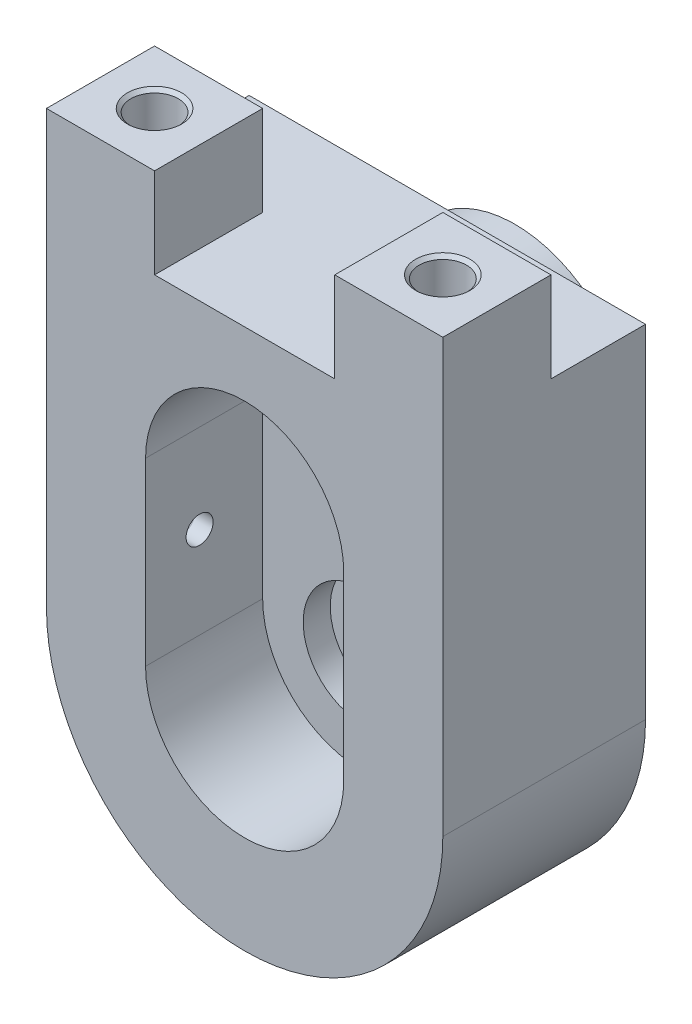
from build123d import *

# Parameters (mm, degrees)
EXTRUDE_1_DEPTH              = 45
CUT_EXTRUDE_1_DEPTH          = 26
SKETCH_4_R                   = 13
CUT_EXTRUDE_2_DEPTH          = 99.1035198
SKETCH_5_R                   = 13
CUT_EXTRUDE_3_DEPTH          = 6
SKETCH_7_W                   = 45.202600284
SKETCH_7_H                   = 48.529850946
CUT_EXTRUDE_4_DEPTH          = 131.224040013
SKETCH_8_R                   = 26
SKETCH_8_R_2                 = 11
EXTRUDE_3_DEPTH              = 15
HOLE_WIZARD_M5_1_D           = 4.2
HOLE_WIZARD_M5_1_DEPTH       = 12
HOLE_WIZARD_M5_1_CSINK_D     = 5.05
HOLE_WIZARD_M5_1_CSINK_ANGLE = 92
HOLE_WIZARD_M5_1_TIP         = 1.2618073
SKETCH_17_R                  = 3


with BuildPart() as part:
    # 스케치1 → 보스-돌출1 (new body)
    with BuildSketch(Plane.XY):
        with BuildLine():
            Line((5.476321218, 36.260519483), (20, 36.260519483))
            Line((20, 36.260519483), (20, 56.260519483))
            Line((20, 56.260519483), (44, 56.260519483))
            Line((44, 56.260519483), (44, -39.739480517))
            ThreePointArc((44, -39.739480517), (0, -83.739480517), (-44, -39.739480517))
            Line((-44, -39.739480517), (-44, 56.260519483))
            Line((-44, 56.260519483), (-20, 56.260519483))
            Line((-20, 56.260519483), (-20, 36.260519483))
            Line((-20, 36.260519483), (5.476321218, 36.260519483))
        make_face()
    extrude(amount=EXTRUDE_1_DEPTH)

    # 스케치3 → 컷-돌출1 (cut)
    with BuildSketch(Plane.XY.offset(45)):
        with BuildLine():
            Line((22, 0), (22, -40))
            ThreePointArc((22, -40), (0, -62), (-22, -40))
            Line((-22, -40), (-22, 0))
            ThreePointArc((-22, 0), (0, 22), (22, 0))
        make_face()
    extrude(amount=-CUT_EXTRUDE_1_DEPTH, mode=Mode.SUBTRACT)

    # 스케치4 → 컷-돌출2 (cut, through all)
    with BuildSketch(Plane.XY.offset(19)):
        Circle(SKETCH_4_R)
    extrude(amount=-CUT_EXTRUDE_2_DEPTH, mode=Mode.SUBTRACT)

    # 스케치5 → 컷-돌출3 (cut)
    with BuildSketch(Plane.XY.offset(19)):
        with Locations((0, -40)):
            Circle(SKETCH_5_R)
    extrude(amount=-CUT_EXTRUDE_3_DEPTH, mode=Mode.SUBTRACT)

    # 스케치7 → 컷-돌출4 (cut, through all)
    with BuildSketch(Plane(origin=(45, 0, 0), x_dir=(0, 0, -1), z_dir=(1, 0, 0))):
        with Locations((1.601300142, 60.525444956)):
            Rectangle(SKETCH_7_W, SKETCH_7_H)
    extrude(amount=-CUT_EXTRUDE_4_DEPTH, mode=Mode.SUBTRACT)

    # 스케치8 → 보스-돌출3 (add)
    with BuildSketch(Plane(origin=(0, 0, 0), x_dir=(-1, 0, 0), z_dir=(0, 0, -1))):
        Circle(SKETCH_8_R)
        Circle(SKETCH_8_R_2, mode=Mode.SUBTRACT)
    extrude(amount=EXTRUDE_3_DEPTH)

    # 스케치13 → M12x1.5 나사 구멍3 (revolve, cut)
    with BuildSketch(Plane(origin=(32, 56.260519483, 33), x_dir=(0, 0, 1), z_dir=(1, 0, 0))):
        Polygon((0, 0), (0, 21.15451825), (5.25, 18), (5.25, 0.7484088), (6.025, 0), align=None)
    m12x1_5_3 = revolve(axis=Axis((32, 62.610519483, 33), (0, -1, 0)), mode=Mode.SUBTRACT)

    # 대칭 복사1: M12x1.5 나사 구멍3 across plane
    add(m12x1_5_3.mirror(Plane(origin=(0, 0, 0), x_dir=(0, 0, 1), z_dir=(1, 0, 0))), mode=Mode.SUBTRACT)

    # M5 나사 구멍1
    with Locations(Plane(origin=(0, 29, 0), x_dir=(-1, 0, 0), z_dir=(0, 0, -1))):
        with Locations((0, 0), (0, -101)):
            CounterSinkHole(HOLE_WIZARD_M5_1_D / 2, HOLE_WIZARD_M5_1_CSINK_D / 2, depth=HOLE_WIZARD_M5_1_DEPTH, counter_sink_angle=HOLE_WIZARD_M5_1_CSINK_ANGLE)
            with Locations((0, 0, -(HOLE_WIZARD_M5_1_DEPTH + HOLE_WIZARD_M5_1_TIP / 2))):  # 118° drill point
                Cone(0, HOLE_WIZARD_M5_1_D / 2, HOLE_WIZARD_M5_1_TIP, mode=Mode.SUBTRACT)

    # 컷-스윕1: sweep along a path in 스케치16
    with BuildLine(Plane.XY.offset(33)) as sweep_1_path:
        Line((-32, 56.260519483), (-32, -13.739480517))
        ThreePointArc((-32, -13.739480517), (-30.242640687, -17.982121204), (-26, -19.739480517))
        Line((-26, -19.739480517), (-16.926354954, -19.739480517))
    # 스케치17 → 컷-스윕1 (sweep, cut)
    with BuildSketch(Plane(origin=(-32, 56.260519483, 33), x_dir=(-1, 0, 0), z_dir=(0, -1, 0))):
        Circle(SKETCH_17_R)
    sweep_1 = sweep(path=sweep_1_path.line, mode=Mode.SUBTRACT)

    # 대칭 복사3: 컷-스윕1 across plane
    add(sweep_1.mirror(Plane(origin=(0, 0, 0), x_dir=(0, 0, 1), z_dir=(1, 0, 0))), mode=Mode.SUBTRACT)


solid = part.part
